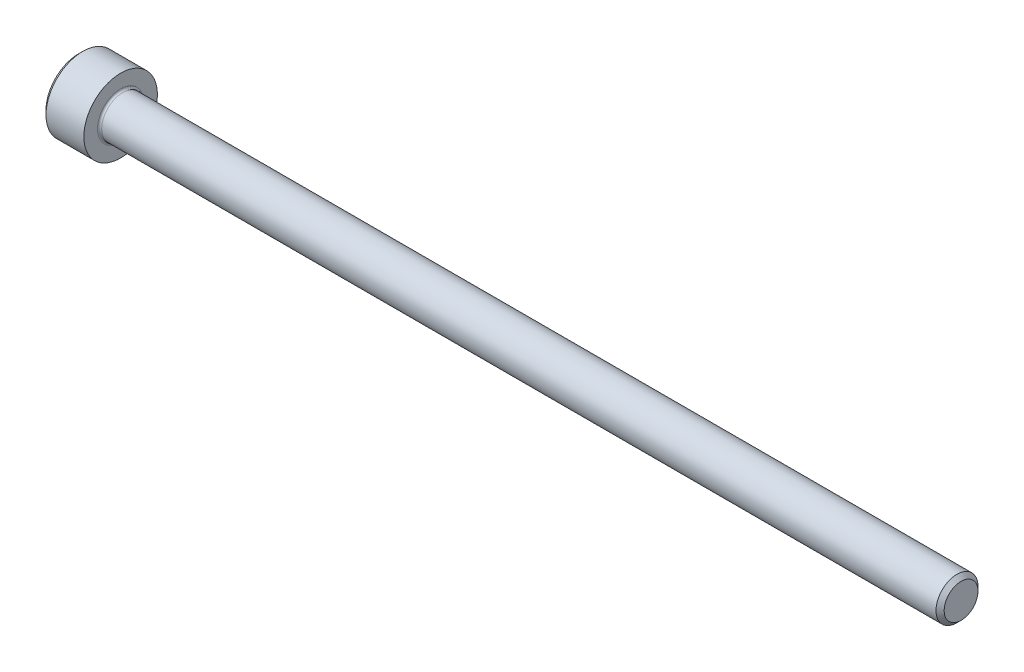
from build123d import *

# Parameters (mm, degrees)
FILLET1_R   = 0.2
HEX_2_DEPTH = 2


with BuildPart() as part:
    # BodySke → Base-Revolve (revolve)
    with BuildSketch(Plane.XY, mode=Mode.PRIVATE) as base_revolve_sk:
        Polygon((0, 0), (0, 3.1), (0.4, 3.5), (4, 3.5), (4, 2), (83.61, 2), (84, 1.61), (84, 0), align=None)
    revolve(base_revolve_sk.sketch.rotate(Axis((-31.75, 0, 0), (1, 0, 0)), 90), axis=Axis((-31.75, 0, 0), (1, 0, 0)))

    # Fillet1
    fillet1_edges = [part.edges().sort_by_distance(p)[0] for p in [
        (4, 0, -2),
    ]]
    fillet(fillet1_edges, radius=FILLET1_R)

    # Sketch2 → Hex-PreBroach (revolve, cut)
    with BuildSketch(Plane.XY, mode=Mode.PRIVATE) as hex_prebroach_sk:
        Polygon((0, 1.5355), (2, 1.5355), (2.886521338, 0), (0, 0), align=None)
    revolve(hex_prebroach_sk.sketch.rotate(Axis((0, 0, 0), (1, 0, 0)), 90), axis=Axis((0, 0, 0), (1, 0, 0)), mode=Mode.SUBTRACT)

    # Sketch3 → Hex 2 (cut)
    with BuildSketch(Plane(origin=(0, 0, 0), x_dir=(0, 0.500000000000001, 0.866025403784438), z_dir=(-1, 0, 0))):
        Polygon((0.886521338, 1.5355), (-0.886521338, 1.5355), (-1.773042677, 0), (-0.886521338, -1.5355), (0.886521338, -1.5355), (1.773042677, 0), align=None)
    extrude(amount=-HEX_2_DEPTH, mode=Mode.SUBTRACT)


solid = part.part
